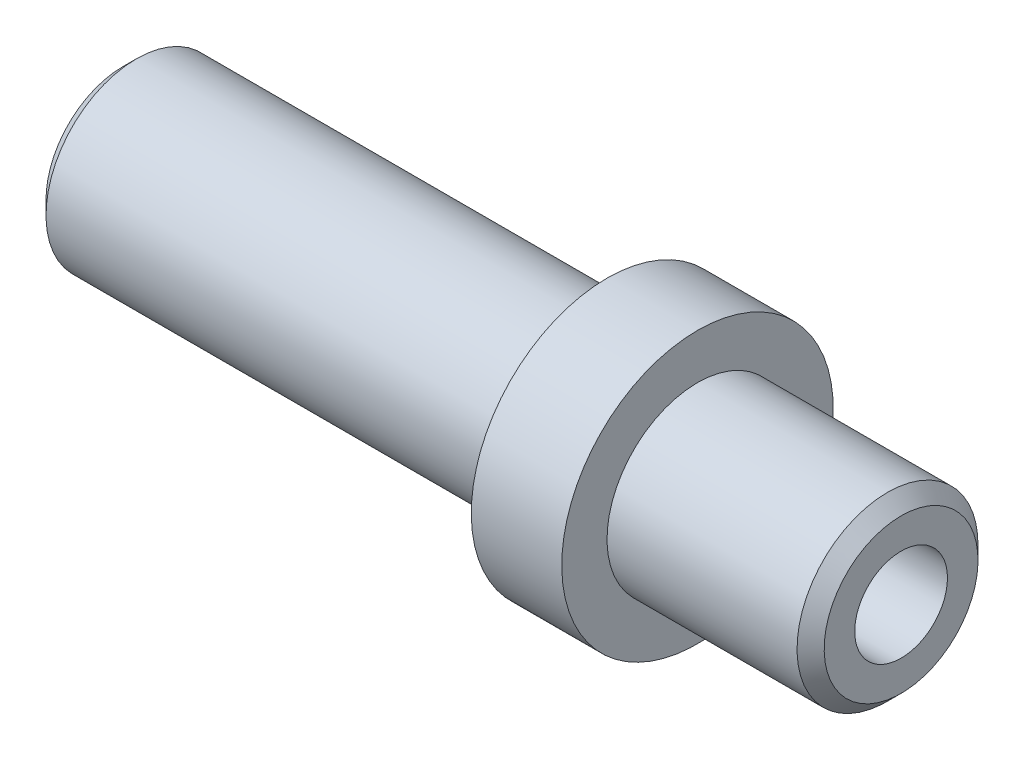
from build123d import *

# Parameters (mm, degrees)
TROU_TARAUD_M2_51_D     = 2.05
TROU_TARAUD_M2_51_DEPTH = 8
TROU_TARAUD_M2_51_TIP   = 0.615882135
TROU_TARAUD_M2_52_D     = 2.05
TROU_TARAUD_M2_52_DEPTH = 8
TROU_TARAUD_M2_52_TIP   = 0.615882135
CHANFREIN1_SIZE         = 0.3


with BuildPart() as part:
    # Esquisse1 → Révolution1 (revolve)
    with BuildSketch(Plane.XY):
        Polygon((0, 0), (0, 2), (10.7, 2), (10.7, 3), (12.7, 3), (12.7, 2), (17.2, 2), (17.2, 0), align=None)
    revolve(axis=Axis((17.2, 0, 0), (-1, 0, 0)))

    # Trou taraudé M2.51
    with Locations(Plane.ZY):
        with Locations((0, 0)):
            Hole(TROU_TARAUD_M2_51_D / 2, depth=TROU_TARAUD_M2_51_DEPTH)
            with Locations((0, 0, -(TROU_TARAUD_M2_51_DEPTH + TROU_TARAUD_M2_51_TIP / 2))):  # 118° drill point
                Cone(0, TROU_TARAUD_M2_51_D / 2, TROU_TARAUD_M2_51_TIP, mode=Mode.SUBTRACT)

    # Trou taraudé M2.52
    with Locations(Plane(origin=(17.2, 0, 0), x_dir=(0, 0, -1), z_dir=(1, 0, 0))):
        with Locations((0, 0)):
            Hole(TROU_TARAUD_M2_52_D / 2, depth=TROU_TARAUD_M2_52_DEPTH)
            with Locations((0, 0, -(TROU_TARAUD_M2_52_DEPTH + TROU_TARAUD_M2_52_TIP / 2))):  # 118° drill point
                Cone(0, TROU_TARAUD_M2_52_D / 2, TROU_TARAUD_M2_52_TIP, mode=Mode.SUBTRACT)

    # Chanfrein1
    chanfrein1_edges = [part.edges().sort_by_distance(p)[0] for p in [
        (17.2, -2, 0),
        (0, -2, 0),
    ]]
    chamfer(chanfrein1_edges, length=CHANFREIN1_SIZE)


solid = part.part
